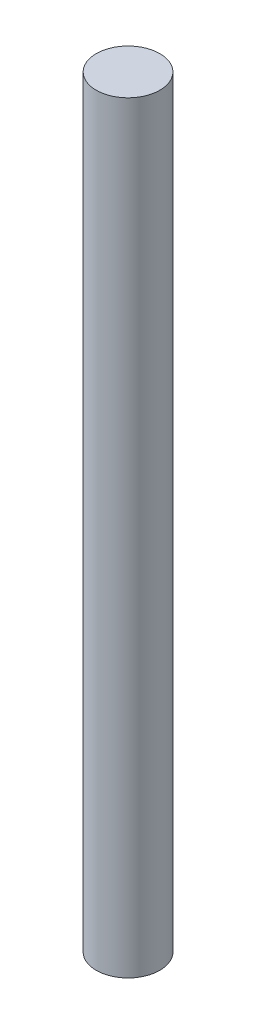
from build123d import *

# Parameters (mm, degrees)
SKETCH1_R           = 6.35
BOSS_EXTRUDE1_DEPTH = 152.4


with BuildPart() as part:
    # Sketch1 → Boss-Extrude1 (new body)
    with BuildSketch(Plane(origin=(0, 0, 0), x_dir=(1, 0, 0), z_dir=(0, 1, 0))):
        with Locations(Location((0, 0, 0), (0, 0, 90))):
            Circle(SKETCH1_R)
    extrude(amount=BOSS_EXTRUDE1_DEPTH)


solid = part.part
